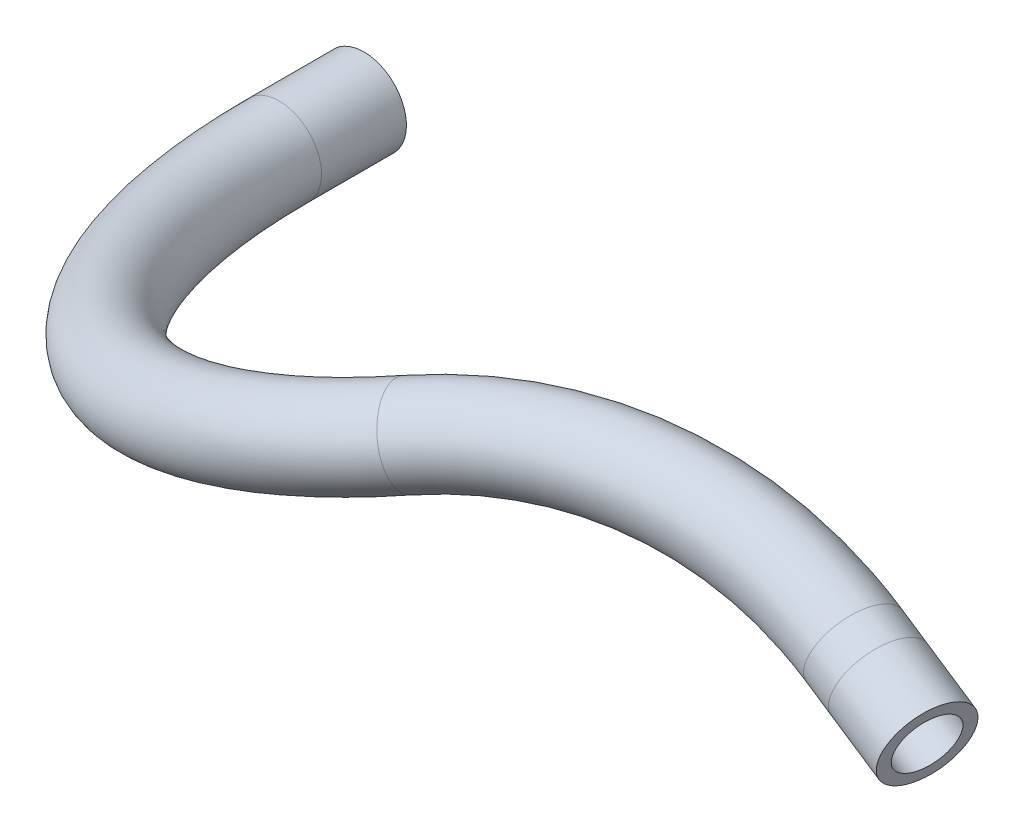
from build123d import *

# Parameters (mm, degrees)
SWEEP1_PROFILE_R     = 13.49375
CUT_SWEEP1_PROFILE_R = 9.525


with BuildPart() as part:
    # Sweep1: sweep along a curve in space
    with BuildLine() as sweep1_path:
        Line((23.5, 73, -27), (23.5, 73, 0))
        ThreePointArc((23.5, 73, 0), (74.341792088, 92.360177629, 104.205083686), (183.308831735, 133.854018751, 119.133217723))
        ThreePointArc((313.846862771, 135.151241794, 107.30619915), (247.643313282, 145.663188238, 104.129125644), (183.308831735, 133.854018751, 119.133217723))
        Line((323.696537416, 131.80975388, 109.239001446), (313.846862771, 135.151241794, 107.30619915))
        Line((323.696537416, 131.80975388, 109.239001446), (342.615480312, 125.391529797, 112.951466843))
    # Sweep1 profile (on start of the path) → Sweep1 (sweep)
    with BuildSketch(Plane(origin=(23.5, 73, -27), x_dir=(1, 0, 0), z_dir=(0, 0, 1))):
        Circle(SWEEP1_PROFILE_R)
    sweep(path=sweep1_path.line)

    # Cut-Sweep1: sweep along a curve in space
    with BuildLine() as cut_sweep1_path:
        Line((23.5, 73, -27), (23.5, 73, 0))
        ThreePointArc((23.5, 73, 0), (74.341792088, 92.360177629, 104.205083686), (183.308831735, 133.854018751, 119.133217723))
        ThreePointArc((313.846862771, 135.151241794, 107.30619915), (247.643313282, 145.663188238, 104.129125644), (183.308831735, 133.854018751, 119.133217723))
        Line((323.696537416, 131.80975388, 109.239001446), (313.846862771, 135.151241794, 107.30619915))
        Line((323.696537416, 131.80975388, 109.239001446), (342.615480312, 125.391529797, 112.951466843))
    # Cut-Sweep1 profile (on start of the path) → Cut-Sweep1 (sweep, cut)
    with BuildSketch(Plane(origin=(23.5, 73, -27), x_dir=(1, 0, 0), z_dir=(0, 0, 1))):
        Circle(CUT_SWEEP1_PROFILE_R)
    sweep(path=cut_sweep1_path.line, mode=Mode.SUBTRACT)


solid = part.part
